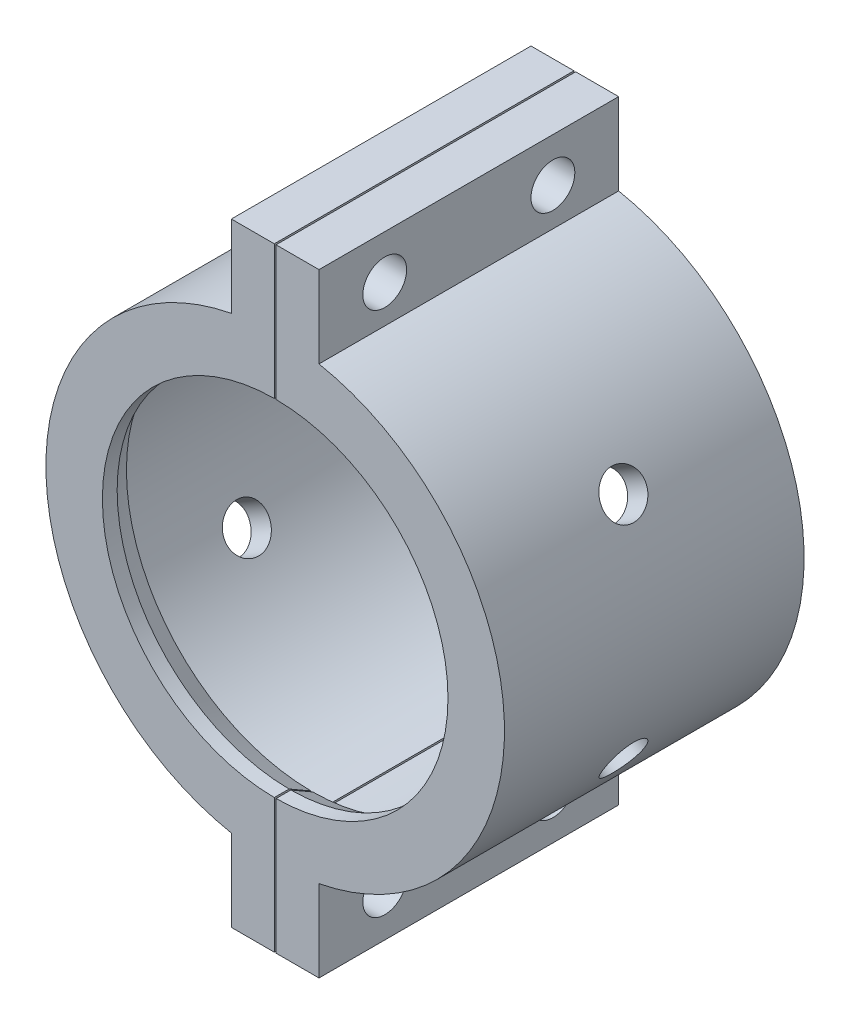
from build123d import *

# Parameters (mm, degrees)
SKETCH8_W                = 3.38
SKETCH8_H                = 38.1
BOSS_EXTRUDE10_DEPTH     = 43.42
CUT_EXTRUDE7_DEPTH       = 71.462752749
CUT_EXTRUDE7_DEPTH_BACK  = 71.462752749
SKETCH18_R               = 3.175
SKETCH23_R               = 3.175
CUT_EXTRUDE9_DEPTH       = 71.462752749
CUT_EXTRUDE11_DEPTH      = 71.462752858
CUT_EXTRUDE11_DEPTH_BACK = 71.462752858
SKETCH25_W               = 0.254
SKETCH25_H               = 127


with BuildPart() as part:
    # Sketch2 → Revolve1 (revolve)
    with BuildSketch(Plane(origin=(0, 0, 0), x_dir=(1, 0, 0), z_dir=(0, 1, 0))):
        Polygon((25.039026144, 0), (25.039026144, 2.14), (26.875, 5.32), (33.225, 5.32), (33.225, 0), align=None)
    revolve(axis=Axis((0, 0, 0), (0, 0, -1)))

    # Sketch8 → Revolve2 (revolve)
    with BuildSketch(Plane(origin=(0, 0, 0), x_dir=(1, 0, 0), z_dir=(0, 1, 0)), mode=Mode.PRIVATE) as revolve2_sk:
        with Locations((-31.535, 24.37)):
            Rectangle(SKETCH8_W, SKETCH8_H)
    revolve(revolve2_sk.sketch.rotate(Axis((0, 0, 0), (0, 0, -1)), 180), axis=Axis((0, 0, 0), (0, 0, -1)))

    # Sketch19 → Boss-Extrude10 (add)
    with BuildSketch(Plane.XY):
        with BuildLine():
            Line((-6.35, 32.612545515), (-6.35, 44.45))
            Line((-6.35, 44.45), (6.35, 44.45))
            Line((6.35, 44.45), (6.35, 32.612545515))
            ThreePointArc((6.35, 32.612545515), (0, 33.225), (-6.35, 32.612545515))
        make_face()
        with BuildLine():
            Line((6.35, -44.45), (-6.35, -44.45))
            Line((-6.35, -44.45), (-6.35, -32.612545515))
            ThreePointArc((-6.35, -32.612545515), (0, -33.225), (6.35, -32.612545515))
            Line((6.35, -32.612545515), (6.35, -44.45))
        make_face()
    extrude(amount=-BOSS_EXTRUDE10_DEPTH)

    # Sketch18 → Cut-Extrude7 (cut, two sides: drawn at the far end of the back side and taken through both)
    with BuildSketch(Plane(origin=(0, 0, 0), x_dir=(0, 0, -1), z_dir=(1, 0, 0)).offset(-CUT_EXTRUDE7_DEPTH_BACK)):
        with Locations(Location((9.525, 38.1, 0), (0, 0, 90))):
            Circle(SKETCH18_R)
        with Locations(Location((33.895, 38.1, 0), (0, 0, 90))):
            Circle(SKETCH18_R)
        with Locations(Location((9.525, -38.1, 0), (0, 0, 90))):
            Circle(SKETCH18_R)
        with Locations(Location((33.895, -38.1, 0), (0, 0, 90))):
            Circle(SKETCH18_R)
    extrude(amount=CUT_EXTRUDE7_DEPTH + CUT_EXTRUDE7_DEPTH_BACK, mode=Mode.SUBTRACT)

    # Sketch23 → Cut-Extrude9 (cut, symmetric)
    with BuildSketch(Plane(origin=(0, 0, 0), x_dir=(-0.5000000000000014, 0.8660254037844378, 0), z_dir=(-0.8660254037844378, -0.5000000000000014, 0))):
        with Locations(Location((0, 21.71, 0), (0, 0, 180))):
            Circle(SKETCH23_R)
    cut_extrude9 = extrude(amount=CUT_EXTRUDE9_DEPTH, both=True, mode=Mode.SUBTRACT)

    # Mirror3: Cut-Extrude9 across plane
    add(cut_extrude9.mirror(Plane.ZX), mode=Mode.SUBTRACT)

    # Sketch25 → Cut-Extrude11 (cut, two sides: drawn at the far end of the back side and taken through both)
    with BuildSketch(Plane.XY.offset(-CUT_EXTRUDE11_DEPTH_BACK)):
        Rectangle(SKETCH25_W, SKETCH25_H)
    extrude(amount=CUT_EXTRUDE11_DEPTH + CUT_EXTRUDE11_DEPTH_BACK, mode=Mode.SUBTRACT)


with BuildPart() as cut_extrude11_piece_1:
    # of the separate pieces the step leaves, piece 1, a body of its own (cut_extrude11_pieces)
    add(part.part.solids().sort_by_distance((-0.127, -25.038704065, 0))[0])


with BuildPart() as cut_extrude11_piece_2:
    # of the separate pieces the step leaves, piece 2, a body of its own (cut_extrude11_pieces)
    add(part.part.solids().sort_by_distance((0.127, 25.038704065, -2.14))[0])


solid = Compound([cut_extrude11_piece_1.part, cut_extrude11_piece_2.part])
